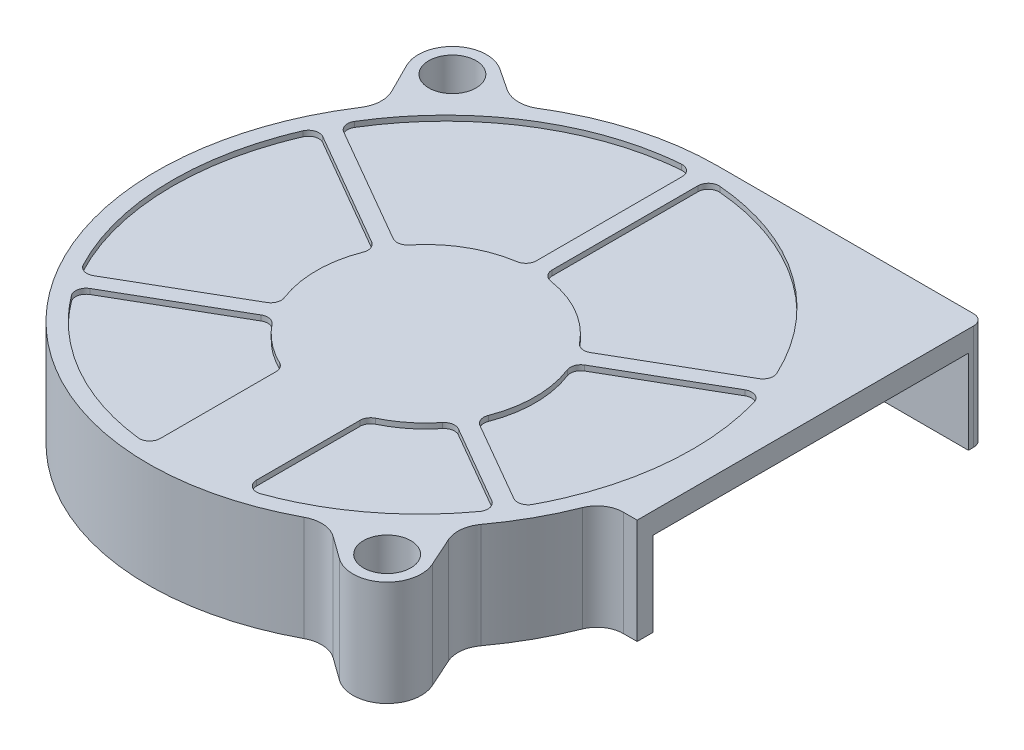
from build123d import *

# Parameters (mm, degrees)
SKETCH18_R          = 2.25
BOSS_EXTRUDE3_DEPTH = 2
CUT_EXTRUDE9_DEPTH  = 0.5
FILLET4_R           = 2.5
BOSS_EXTRUDE4_START = -8
SKETCH22_R          = 2.25
BOSS_EXTRUDE4_DEPTH = 8


with BuildPart() as part:
    # Sketch18 → Boss-Extrude3 (new body)
    with BuildSketch(Plane(origin=(0, 0, 0), x_dir=(1, 0, 0), z_dir=(0, 1, 0))):
        with BuildLine():
            Line((-23.005700489, 21.173936517), (-21.582450949, 18.333239239))
            ThreePointArc((-21.582450949, 18.333239239), (-21.290226852, 16.922030245), (-21.738588357, 15.552403394))
            add(Edge.make_bspline(
                [(-21.738588357, 15.552403394), (-74.642199686, -65.790312539), (9.324862756, -20.895925284)],
                knots=[4.619035423, 4.619035423, 4.619035423, 7.234825226, 7.234825226, 7.234825226], degree=2, weights=[1, 0.259883374, 1]))
            ThreePointArc((9.324862756, -20.895925284), (10.831803609, -20.571378647), (12.282148638, -21.093586031))
            Line((12.282148638, -21.093586031), (14.423232763, -22.636631148))
            ThreePointArc((14.423232763, -22.636631148), (18.378398581, -22.5178413), (19.287328639, -18.666699414))
            Line((19.287328639, -18.666699414), (18.031066286, -15.874036932))
            ThreePointArc((18.031066286, -15.874036932), (17.800260945, -14.429576005), (18.329372436, -13.065838675))
            add(Edge.make_bspline(
                [(18.329372436, -13.065838675), (20.952057231, -9.501687367), (22.333293139, -5.3)],
                knots=[1.416240338, 1.416240338, 1.416240338, 1.752231262, 1.752231262, 1.752231262], degree=2, weights=[1, 0.985921919, 1]))
            Line((22.333293139, -5.3), (25.4, -5.3))
            Line((25.4, -5.3), (25.4, 26.7))
            ThreePointArc((25.4, 26.7), (25.107106781, 27.407106781), (24.4, 27.7))
            Line((24.4, 27.7), (-0.010581904, 27.7))
            add(Edge.make_bspline(
                [(-0.010581904, 27.7), (-7.028971285, 27.7), (-13.197915422, 23.907683644)],
                knots=[3.605852843, 3.605852843, 3.605852843, 4.154921422, 4.154921422, 4.154921422], degree=2, weights=[1, 0.962551555, 1]))
            ThreePointArc((-13.197915422, 23.907683644), (-14.708437667, 23.493357847), (-16.205141277, 23.955117118))
            Line((-16.205141277, 23.955117118), (-18.311498324, 25.343379249))
            ThreePointArc((-18.311498324, 25.343379249), (-22.258262373, 25.059651887), (-23.005700489, 21.173936517))
        make_face()
        with Locations(Location((16.3234107, -20, 0), (0, 0, 270))):
            Circle(SKETCH18_R, mode=Mode.SUBTRACT)
        with Locations(Location((-20.1, 22.629754043, 0), (0, 0, 270))):
            Circle(SKETCH18_R, mode=Mode.SUBTRACT)
    extrude(amount=BOSS_EXTRUDE3_DEPTH)

    # Sketch21 → Cut-Extrude9 (cut)
    with BuildSketch(Plane.XZ.offset(-2)):
        with BuildLine():
            Line((9.380671427, 6.281958578), (16.889664258, 10.61727761))
            ThreePointArc((16.889664258, 10.61727761), (17.367921917, 11.27590978), (17.198057734, 12.071945509))
            add(Edge.make_bspline(
                [(17.198057734, 12.071945509), (12.554899126, 18.448479912), (5.336676879, 21.029359579)],
                knots=[1.72060662, 1.72060662, 1.72060662, 2.341313714, 2.341313714, 2.341313714], degree=2, weights=[1, 0.952225658, 1]))
            ThreePointArc((5.336676879, 21.029359579), (4.424099348, 20.905259025), (4, 20.087739337))
            Line((4, 20.087739337), (4, 10.24499878))
            ThreePointArc((4, 10.24499878), (4.151885476, 9.715185837), (4.561403509, 9.346314676))
            ThreePointArc((4.561403509, 9.346314676), (6.487216138, 8.128716183), (8.101665162, 6.520967843))
            ThreePointArc((8.101665162, 6.520967843), (8.696980161, 6.164999994), (9.380671427, 6.281958578))
        make_face()
        with BuildLine():
            Line((10.130671427, 4.982920472), (17.749498035, 9.381652065))
            ThreePointArc((17.749498035, 9.381652065), (18.524335906, 9.477117246), (19.131663578, 8.9865661))
            add(Edge.make_bspline(
                [(21.249872044, -9.970202217), (24.056123087, -0.237950121), (19.131663578, 8.9865661)],
                knots=[0.769514416, 0.769514416, 0.769514416, 1.572568981, 1.572568981, 1.572568981], degree=2, weights=[1, 0.920465168, 1]))
            ThreePointArc((21.249872044, -9.970202217), (20.662940109, -10.620604923), (19.789018765, -10.559169907))
            Line((19.789018765, -10.559169907), (10.130671427, -4.982920472))
            ThreePointArc((10.130671427, -4.982920472), (9.68753669, -4.449305759), (9.69815639, -3.755763922))
            ThreePointArc((9.69815639, -3.755763922), (10.4, 0), (9.69815639, 3.755763922))
            ThreePointArc((9.69815639, 3.755763922), (9.68753669, 4.449305759), (10.130671427, 4.982920472))
        make_face()
        with BuildLine():
            Line((-10.130671427, -4.982920472), (-21.139286828, -11.338747537))
            ThreePointArc((-21.139286828, -11.338747537), (-21.9528823, -11.422278809), (-22.556709037, -10.870637315))
            add(Edge.make_bspline(
                [(-21.961052126, 10.614886102), (-27.404440798, 0.306158598), (-22.556709037, -10.870637315)],
                knots=[3.708622327, 3.708622327, 3.708622327, 4.627736191, 4.627736191, 4.627736191], degree=2, weights=[1, 0.896249109, 1]))
            ThreePointArc((-21.961052126, 10.614886102), (-21.353777236, 11.108813785), (-20.576761985, 11.013973667))
            Line((-20.576761985, 11.013973667), (-10.130671427, 4.982920472))
            ThreePointArc((-10.130671427, 4.982920472), (-9.68753669, 4.449305759), (-9.69815639, 3.755763922))
            ThreePointArc((-9.69815639, 3.755763922), (-10.4, 0), (-9.69815639, -3.755763922))
            ThreePointArc((-9.69815639, -3.755763922), (-9.68753669, -4.449305759), (-10.130671427, -4.982920472))
        make_face()
        with BuildLine():
            Line((9.380671427, -6.281958578), (19.541752537, -12.148461491))
            ThreePointArc((19.541752537, -12.148461491), (19.995803, -12.714840914), (19.947118982, -13.43911803))
            add(Edge.make_bspline(
                [(1.832210196, -26.124693311), (14.486982659, -25.080808446), (19.947118982, -13.43911803)],
                knots=[5.899428803, 5.899428803, 5.899428803, 6.896434086, 6.896434086, 6.896434086], degree=2, weights=[1, 0.87829945, 1]))
            ThreePointArc((1.832210196, -26.124693311), (1.072582181, -25.86367676), (0.75, -25.128078298))
            Line((0.75, -25.128078298), (0.75, -11.26487905))
            ThreePointArc((0.75, -11.26487905), (0.990556529, -10.614305753), (1.596491228, -10.276731764))
            ThreePointArc((1.596491228, -10.276731764), (5.2, -9.006664199), (8.101665162, -6.520967843))
            ThreePointArc((8.101665162, -6.520967843), (8.696980161, -6.164999994), (9.380671427, -6.281958578))
        make_face()
        with BuildLine():
            Line((-4, 10.24499878), (-4, 21.25280893))
            ThreePointArc((-4, 21.25280893), (-4.335734031, 22.000305233), (-5.117501446, 22.245881642))
            add(Edge.make_bspline(
                [(-5.117501446, 22.245881642), (-14.362152408, 21.152044459), (-19.994447245, 13.707442628)],
                knots=[2.791698852, 2.791698852, 2.791698852, 3.552181829, 3.552181829, 3.552181829], degree=2, weights=[1, 0.928575035, 1]))
            ThreePointArc((-19.994447245, 13.707442628), (-20.177080874, 12.905669736), (-19.696965717, 12.238073863))
            Line((-19.696965717, 12.238073863), (-9.380671427, 6.281958578))
            ThreePointArc((-9.380671427, 6.281958578), (-8.696980161, 6.164999994), (-8.101665162, 6.520967843))
            ThreePointArc((-8.101665162, 6.520967843), (-6.487216138, 8.128716183), (-4.561403509, 9.346314676))
            ThreePointArc((-4.561403509, 9.346314676), (-4.151885476, 9.715185837), (-4, 10.24499878))
        make_face()
        with BuildLine():
            Line((-9.380671427, -6.281958578), (-20.52543024, -12.716388078))
            ThreePointArc((-20.52543024, -12.716388078), (-20.994462803, -13.335480514), (-20.878910009, -14.103539458))
            add(Edge.make_bspline(
                [(-20.878910009, -14.103539458), (-14.140957085, -25.138695581), (-1.830055545, -26.127424933)],
                knots=[4.775770168, 4.775770168, 4.775770168, 5.742874897, 5.742874897, 5.742874897], degree=2, weights=[1, 0.885348922, 1]))
            ThreePointArc((-1.830055545, -26.127424933), (-1.071787476, -25.865500348), (-0.75, -25.130634529))
            Line((-0.75, -25.130634529), (-0.75, -11.26487905))
            ThreePointArc((-0.75, -11.26487905), (-0.990556529, -10.614305753), (-1.596491228, -10.276731764))
            ThreePointArc((-1.596491228, -10.276731764), (-5.2, -9.006664199), (-8.101665162, -6.520967843))
            ThreePointArc((-8.101665162, -6.520967843), (-8.696980161, -6.164999994), (-9.380671427, -6.281958578))
        make_face()
    extrude(amount=CUT_EXTRUDE9_DEPTH, mode=Mode.SUBTRACT)

    # Fillet4
    fillet4_edges = [part.edges().sort_by_distance(p)[0] for p in [
        (22.333293139, 1, 5.3),
    ]]
    fillet(fillet4_edges, radius=FILLET4_R)

    # Sketch22 → Boss-Extrude4 (add)
    with BuildSketch(Plane(origin=(0, 0, 0), x_dir=(1, 0, 0), z_dir=(0, 1, 0)).offset(BOSS_EXTRUDE4_START)):
        with BuildLine():
            Line((25.4, 26.2), (0.134529672, 26.2))
            add(Edge.make_bspline(
                [(0.134529672, 26.2), (-45.132401673, 26.493894021), (-21.1535928, -12.020990224), (2.825216073, -50.535874469), (20.373398026, -6.307772844)],
                knots=[0.456497732, 0.456497732, 0.456497732, 2.643550488, 2.643550488, 4.830603244, 4.830603244, 4.830603244], degree=2, weights=[1, 0.459355916, 1, 0.459355916, 1]))
            ThreePointArc((20.373398026, -6.307772844), (21.845090667, -4.485719639), (24.084632068, -3.8))
            Line((24.084632068, -3.8), (25.4, -3.8))
            Line((25.4, -3.8), (25.4, -5.3))
            Line((25.4, -5.3), (24.084632068, -5.3))
            ThreePointArc((24.084632068, -5.3), (22.680778329, -5.731378556), (21.761398508, -6.876644257))
            add(Edge.make_bspline(
                [(18.329372436, -13.065838675), (20.443306322, -10.193064851), (21.761398508, -6.876644257)],
                knots=[1.416240338, 1.416240338, 1.416240338, 1.687948198, 1.687948198, 1.687948198], degree=2, weights=[1, 0.990786039, 1]))
            ThreePointArc((18.329372436, -13.065838675), (17.800260945, -14.429576005), (18.031066286, -15.874036932))
            Line((18.031066286, -15.874036932), (19.287328639, -18.666699414))
            ThreePointArc((19.287328639, -18.666699414), (18.378398581, -22.5178413), (14.423232763, -22.636631148))
            Line((14.423232763, -22.636631148), (12.282148638, -21.093586031))
            ThreePointArc((12.282148638, -21.093586031), (10.831803609, -20.571378647), (9.324862756, -20.895925284))
            add(Edge.make_bspline(
                [(-21.738588357, 15.552403394), (-74.642199686, -65.790312539), (9.324862756, -20.895925284)],
                knots=[4.619035423, 4.619035423, 4.619035423, 7.234825226, 7.234825226, 7.234825226], degree=2, weights=[1, 0.259883374, 1]))
            ThreePointArc((-21.738588357, 15.552403394), (-21.290226852, 16.922030245), (-21.582450949, 18.333239239))
            Line((-21.582450949, 18.333239239), (-23.005700489, 21.173936517))
            ThreePointArc((-23.005700489, 21.173936517), (-22.258262373, 25.059651887), (-18.311498324, 25.343379249))
            Line((-18.311498324, 25.343379249), (-16.205141277, 23.955117118))
            ThreePointArc((-16.205141277, 23.955117118), (-14.708437667, 23.493357847), (-13.197915422, 23.907683644))
            add(Edge.make_bspline(
                [(-0.010581904, 27.7), (-7.028971285, 27.7), (-13.197915422, 23.907683644)],
                knots=[3.605852843, 3.605852843, 3.605852843, 4.154921422, 4.154921422, 4.154921422], degree=2, weights=[1, 0.962551555, 1]))
            Line((-0.010581904, 27.7), (24.4, 27.7))
            ThreePointArc((24.4, 27.7), (25.107106781, 27.407106781), (25.4, 26.7))
            Line((25.4, 26.7), (25.4, 26.2))
        make_face()
        with Locations(Location((16.3234107, -20, 0), (0, 0, 270))):
            Circle(SKETCH22_R, mode=Mode.SUBTRACT)
        with Locations(Location((-20.1, 22.629754043, 0), (0, 0, 270))):
            Circle(SKETCH22_R, mode=Mode.SUBTRACT)
    extrude(amount=BOSS_EXTRUDE4_DEPTH)


solid = part.part
